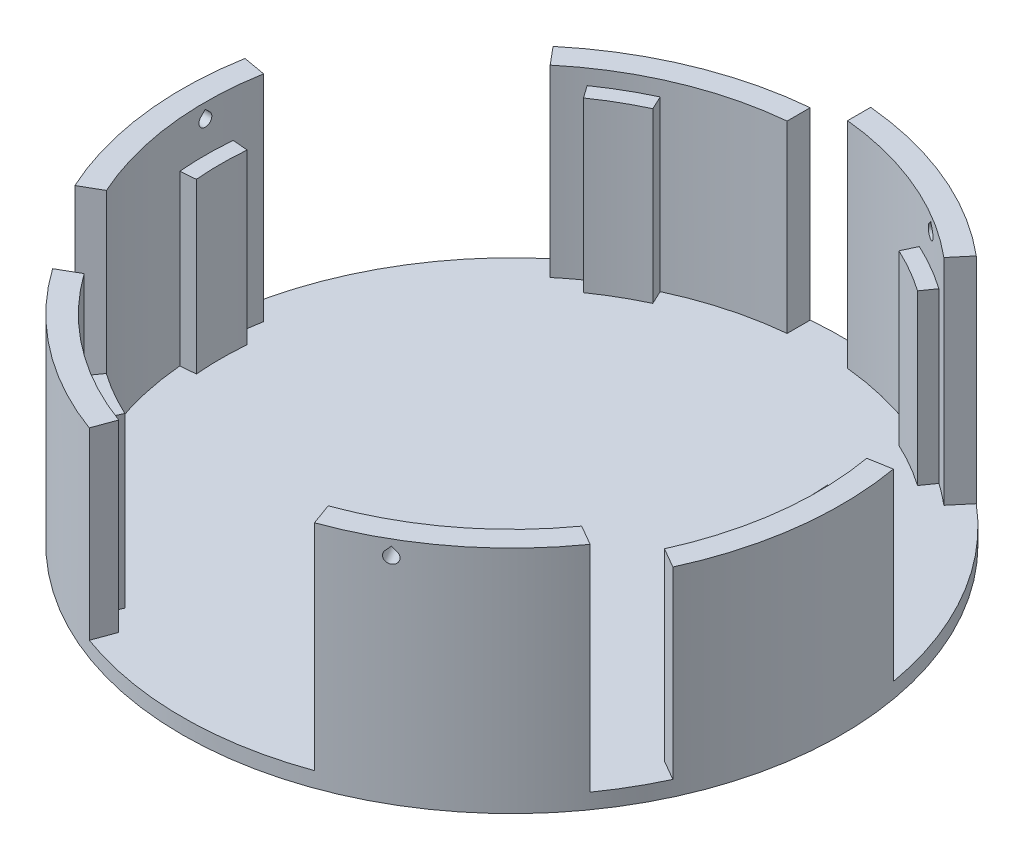
from build123d import *

# Parameters (mm, degrees)
SKETCH1_R               = 107.5
BOSS_EXTRUDE1_DEPTH     = 5
BOSS_EXTRUDE2_DEPTH     = 70
CUT_EXTRUDE2_DEPTH      = 10
CUT_EXTRUDE2_DEPTH_BACK = 10
BOSS_EXTRUDE4_DEPTH     = 55
CUT_EXTRUDE3_DEPTH      = 10
CUT_EXTRUDE3_DEPTH_BACK = 10
CUT_EXTRUDE4_DEPTH      = 10
CUT_EXTRUDE4_DEPTH_BACK = 10
CUT_EXTRUDE5_DEPTH      = 80
CUT_EXTRUDE6_START      = -10
CUT_EXTRUDE6_DEPTH      = 10


with BuildPart() as part:
    # Sketch1 → Boss-Extrude1 (new body)
    with BuildSketch(Plane(origin=(0, 0, 0), x_dir=(1, 0, 0), z_dir=(0, 1, 0))):
        Circle(SKETCH1_R)
    extrude(amount=BOSS_EXTRUDE1_DEPTH)

    # Sketch2 → Boss-Extrude2 (add)
    with BuildSketch(Plane(origin=(0, 5, 0), x_dir=(1, 0, 0), z_dir=(0, 1, 0))):
        with BuildLine():
            Line((-9.756097561, 99.522954942), (-9.756097561, 107.056380288))
            ThreePointArc((-9.756097561, 107.056380288), (-93.036435814, 53.856026692), (-97.694053207, -44.856682534))
            Line((-97.694053207, -44.856682534), (-91.168439698, -41.089117817))
            ThreePointArc((-91.168439698, -41.089117817), (-86.541200053, 50.106094373), (-9.756097561, 99.522954942))
        make_face()
        with BuildLine():
            Line((10, 99.498743711), (10, 107.033873143))
            ThreePointArc((10, 107.033873143), (93.158905169, 53.643903547), (97.591593747, -45.079161814))
            Line((97.591593747, -45.079161814), (91.06745602, -41.312449141))
            ThreePointArc((91.06745602, -41.312449141), (86.663750638, 49.893830534), (10, 99.498743711))
        make_face()
        with BuildLine():
            Line((81.168439698, -58.409625893), (87.694053207, -62.177190609))
            ThreePointArc((87.694053207, -62.177190609), (-0.122469355, -107.499930238), (-87.835496186, -61.977218474))
            Line((-87.835496186, -61.977218474), (-81.311358459, -58.210505801))
            ThreePointArc((-81.311358459, -58.210505801), (-0.122550585, -99.999924907), (81.168439698, -58.409625893))
        make_face()
    extrude(amount=BOSS_EXTRUDE2_DEPTH)

    # Sketch4 → Cut-Extrude2 (cut, two sides: drawn at the far end of the back side and taken through both)
    with BuildSketch(Plane.ZY.offset(107.5).offset(-CUT_EXTRUDE2_DEPTH_BACK)):
        with BuildLine():
            Line((-1.48492424, 71.48492424), (0, 72.969848481))
            Line((0, 72.969848481), (1.48492424, 71.48492424))
            ThreePointArc((1.48492424, 71.48492424), (0, 67.9), (-1.48492424, 71.48492424))
        make_face()
    extrude(amount=CUT_EXTRUDE2_DEPTH + CUT_EXTRUDE2_DEPTH_BACK, mode=Mode.SUBTRACT)

    # Sketch6 → Boss-Extrude4 (add)
    with BuildSketch(Plane(origin=(0, 5, 0), x_dir=(1, 0, 0), z_dir=(0, 1, 0))):
        with BuildLine():
            Line((94.638496319, 8.279795561), (99.619469809, 8.715574275))
            ThreePointArc((99.619469809, 8.715574275), (100, 0), (99.619469809, -8.715574275))
            Line((99.619469809, -8.715574275), (94.638496319, -8.279795561))
            ThreePointArc((94.638496319, -8.279795561), (95, 0), (94.638496319, 8.279795561))
        make_face()
        with BuildLine():
            Line((54.489761453, -77.819444207), (57.357643635, -81.915204429))
            ThreePointArc((57.357643635, -81.915204429), (50, -86.602540378), (42.261826174, -90.630778704))
            Line((42.261826174, -90.630778704), (40.148734865, -86.099239768))
            ThreePointArc((40.148734865, -86.099239768), (47.5, -82.27241336), (54.489761453, -77.819444207))
        make_face()
        with BuildLine():
            Line((-40.148734865, -86.099239768), (-42.261826174, -90.630778704))
            ThreePointArc((-42.261826174, -90.630778704), (-50, -86.602540378), (-57.357643635, -81.915204429))
            Line((-57.357643635, -81.915204429), (-54.489761453, -77.819444207))
            ThreePointArc((-54.489761453, -77.819444207), (-47.5, -82.27241336), (-40.148734865, -86.099239768))
        make_face()
        with BuildLine():
            Line((-94.638496319, -8.279795561), (-99.619469809, -8.715574275))
            ThreePointArc((-99.619469809, -8.715574275), (-100, 0), (-99.619469809, 8.715574275))
            Line((-99.619469809, 8.715574275), (-94.638496319, 8.279795561))
            ThreePointArc((-94.638496319, 8.279795561), (-95, 0), (-94.638496319, -8.279795561))
        make_face()
        with BuildLine():
            Line((-54.489761453, 77.819444207), (-57.357643635, 81.915204429))
            ThreePointArc((-57.357643635, 81.915204429), (-50, 86.602540378), (-42.261826174, 90.630778704))
            Line((-42.261826174, 90.630778704), (-40.148734865, 86.099239768))
            ThreePointArc((-40.148734865, 86.099239768), (-47.5, 82.27241336), (-54.489761453, 77.819444207))
        make_face()
        with BuildLine():
            Line((40.148734865, 86.099239768), (42.261826174, 90.630778704))
            ThreePointArc((42.261826174, 90.630778704), (50, 86.602540378), (57.357643635, 81.915204429))
            Line((57.357643635, 81.915204429), (54.489761453, 77.819444207))
            ThreePointArc((54.489761453, 77.819444207), (47.5, 82.27241336), (40.148734865, 86.099239768))
        make_face()
    extrude(amount=BOSS_EXTRUDE4_DEPTH)

    # Sketch7 → Cut-Extrude3 (cut, two sides: drawn at the far end of the back side and taken through both)
    with BuildSketch(Plane(origin=(53.75, 0, 93.097730907), x_dir=(0.8660254037844344, 0, -0.5000000000000075), z_dir=(0.5000000000000075, 0, 0.8660254037844344)).offset(-CUT_EXTRUDE3_DEPTH_BACK)):
        with BuildLine():
            Line((0, 72.969848481), (-1.48492424, 71.48492424))
            ThreePointArc((-1.48492424, 71.48492424), (0, 67.9), (1.48492424, 71.48492424))
            Line((1.48492424, 71.48492424), (0, 72.969848481))
        make_face()
    extrude(amount=CUT_EXTRUDE3_DEPTH + CUT_EXTRUDE3_DEPTH_BACK, mode=Mode.SUBTRACT)

    # Sketch8 → Cut-Extrude4 (cut, two sides: drawn at the far end of the back side and taken through both)
    with BuildSketch(Plane(origin=(53.75, 0, -93.097730907), x_dir=(-0.8660254037844379, 0, -0.5000000000000013), z_dir=(0.5000000000000012, 0, -0.8660254037844378)).offset(-CUT_EXTRUDE4_DEPTH_BACK)):
        with BuildLine():
            Line((-1.48492424, 71.48492424), (0, 72.969848481))
            Line((0, 72.969848481), (1.48492424, 71.48492424))
            ThreePointArc((1.48492424, 71.48492424), (0, 67.9), (-1.48492424, 71.48492424))
        make_face()
    extrude(amount=CUT_EXTRUDE4_DEPTH + CUT_EXTRUDE4_DEPTH_BACK, mode=Mode.SUBTRACT)

    # Sketch10 → Cut-Extrude5 (cut)
    with BuildSketch(Plane(origin=(0, 5, 0), x_dir=(1, 0, 0), z_dir=(0, 1, 0))):
        with BuildLine():
            Line((-34.309046601, -93.930236459), (-36.882225096, -100.975004194))
            ThreePointArc((-36.882225096, -100.975004194), (-0.122469355, -107.499930238), (36.652057999, -101.058778166))
            Line((36.652057999, -101.058778166), (34.094937673, -94.008165736))
            ThreePointArc((34.094937673, -94.008165736), (-0.113924981, -99.999935105), (-34.309046601, -93.930236459))
        make_face()
        with BuildLine():
            Line((-64.191447657, 76.677624166), (-69.005806231, 82.428445979))
            ThreePointArc((-69.005806231, 82.428445979), (-93.036435814, 53.856026692), (-105.845498167, 18.787775755))
            Line((-105.845498167, 18.787775755), (-98.460928527, 17.477000703))
            ThreePointArc((-98.460928527, 17.477000703), (-86.545521688, 50.09862948), (-64.191447657, 76.677624166))
        make_face()
        with BuildLine():
            Line((98.500494258, 17.252612293), (105.888031327, 18.546558215))
            ThreePointArc((105.888031327, 18.546558215), (93.158905169, 53.643903547), (69.193440168, 82.271002411))
            Line((69.193440168, 82.271002411), (64.365990854, 76.531165034))
            ThreePointArc((64.365990854, 76.531165034), (86.659446669, 49.901305625), (98.500494258, 17.252612293))
        make_face()
    extrude(amount=CUT_EXTRUDE5_DEPTH, mode=Mode.SUBTRACT)

    # Sketch11 → Cut-Extrude6 (cut)
    with BuildSketch(Plane(origin=(0, 75, 0), x_dir=(1, 0, 0), z_dir=(0, 1, 0)).offset(CUT_EXTRUDE6_START)):
        with BuildLine():
            Line((-64.191447657, 76.677624166), (-69.005806231, 82.428445979))
            ThreePointArc((-69.005806231, 82.428445979), (-41.261279177, 99.266091092), (-9.756097561, 107.056380288))
            Line((-9.756097561, 107.056380288), (-9.075439592, 99.587330501))
            ThreePointArc((-9.075439592, 99.587330501), (-38.382585281, 92.340549853), (-64.191447657, 76.677624166))
        make_face()
        with BuildLine():
            Line((98.500494258, 17.252612293), (105.888031327, 18.546558215))
            ThreePointArc((105.888031327, 18.546558215), (106.597596209, -13.899729586), (97.591593747, -45.079161814))
            Line((97.591593747, -45.079161814), (90.782877904, -41.934104013))
            ThreePointArc((90.782877904, -41.934104013), (99.160554613, -12.92998101), (98.500494258, 17.252612293))
        make_face()
        with BuildLine():
            Line((-34.309046601, -93.930236459), (-36.882225096, -100.975004194))
            ThreePointArc((-36.882225096, -100.975004194), (-65.336317032, -85.366361506), (-87.835496186, -61.977218474))
            Line((-87.835496186, -61.977218474), (-81.707438313, -57.653226487))
            ThreePointArc((-81.707438313, -57.653226487), (-60.777969332, -79.410568843), (-34.309046601, -93.930236459))
        make_face()
    extrude(amount=CUT_EXTRUDE6_DEPTH, mode=Mode.SUBTRACT)


solid = part.part
